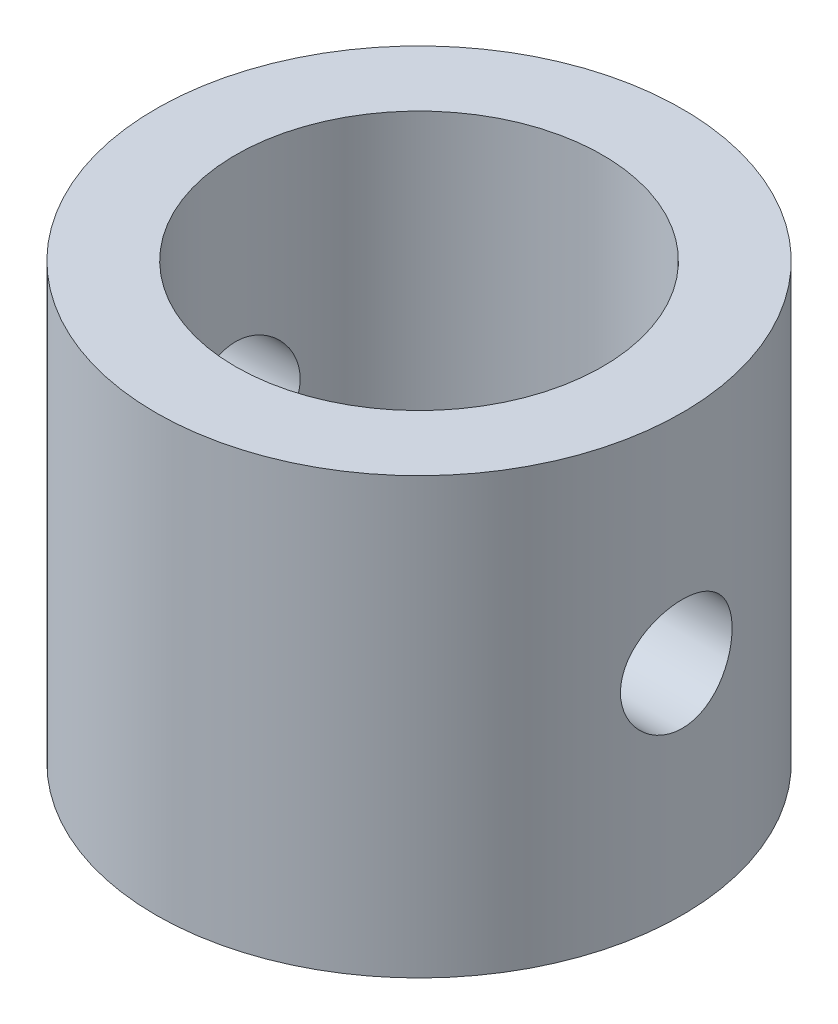
from build123d import *

# Parameters (mm, degrees)
SKETCH1_R               = 23.0505
SKETCH1_R_2             = 16.0655
BOSS_EXTRUDE1_DEPTH     = 38.1
CUT_EXTRUDE1_DEPTH      = 51.142408204
CUT_EXTRUDE1_DEPTH_BACK = 51.142408204
SKETCH2_R               = 4.8895


with BuildPart() as part:
    # Sketch1 → Boss-Extrude1 (new body)
    with BuildSketch(Plane(origin=(0, 0, 0), x_dir=(-1, 0, 0), z_dir=(0, 1, 0))):
        with Locations(Location((0, 0, 0), (0, 0, 270))):
            Circle(SKETCH1_R)
        with Locations(Location((0, 0, 0), (0, 0, 270))):
            Circle(SKETCH1_R_2, mode=Mode.SUBTRACT)
    extrude(amount=BOSS_EXTRUDE1_DEPTH)

    # Sketch2 → Cut-Extrude1 (cut, two sides: drawn at the far end of the back side and taken through both)
    with BuildSketch(Plane.YZ.offset(-CUT_EXTRUDE1_DEPTH_BACK)):
        with Locations(Location((19.05, 0, 0), (0, 0, 270))):
            Circle(SKETCH2_R)
    extrude(amount=CUT_EXTRUDE1_DEPTH + CUT_EXTRUDE1_DEPTH_BACK, mode=Mode.SUBTRACT)


solid = part.part
